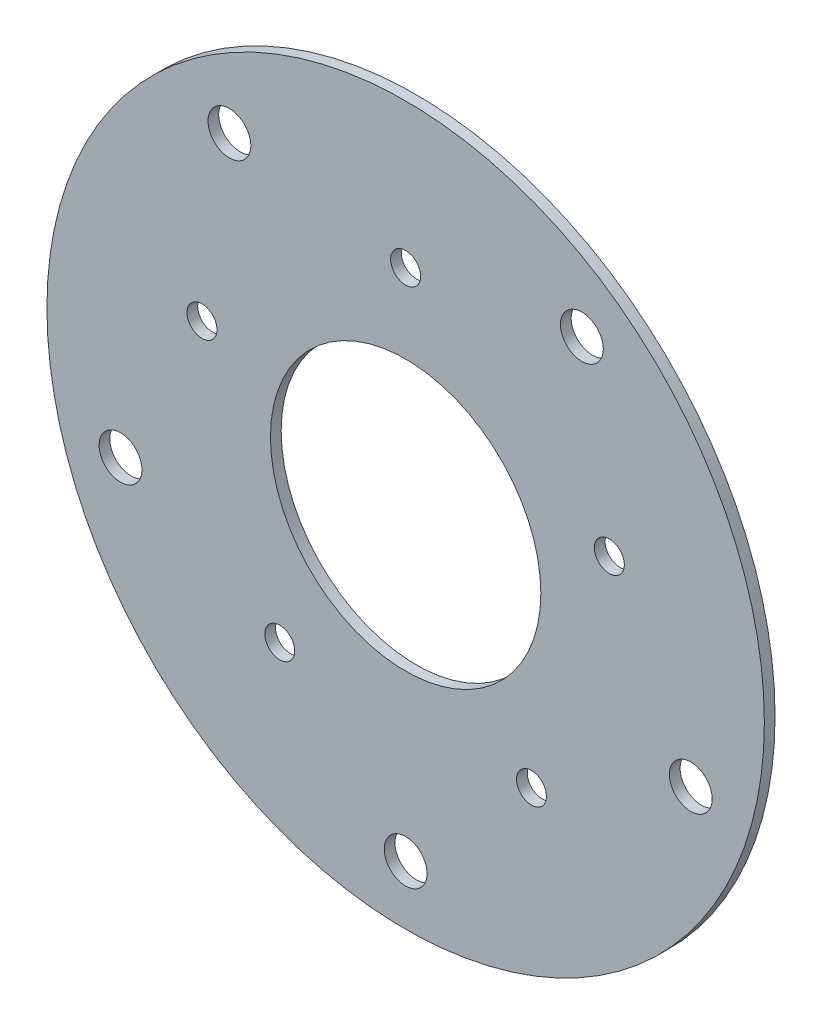
from build123d import *

# Parameters (mm, degrees)
SKETCH_1_R      = 33.5
SKETCH_1_R_2    = 12.625
SKETCH_1_R_3    = 2
SKETCH_1_R_4    = 1.4
EXTRUDE_1_DEPTH = 1


with BuildPart() as part:
    # 草图1 → 凸台-拉伸1 (new body)
    with BuildSketch(Plane.XY):
        Circle(SKETCH_1_R)
        Circle(SKETCH_1_R_2, mode=Mode.SUBTRACT)
        with Locations((0, -28)):
            Circle(SKETCH_1_R_3, mode=Mode.SUBTRACT)
        with Locations((-26.629582456, -8.652475842)):
            Circle(SKETCH_1_R_3, mode=Mode.SUBTRACT)
        with Locations((-16.457987064, 22.652475842)):
            Circle(SKETCH_1_R_3, mode=Mode.SUBTRACT)
        with Locations((16.457987064, 22.652475842)):
            Circle(SKETCH_1_R_3, mode=Mode.SUBTRACT)
        with Locations((26.629582456, -8.652475842)):
            Circle(SKETCH_1_R_3, mode=Mode.SUBTRACT)
        with Locations((-11.755705046, -16.180339887)):
            Circle(SKETCH_1_R_4, mode=Mode.SUBTRACT)
        with Locations((-19.021130326, 6.180339887)):
            Circle(SKETCH_1_R_4, mode=Mode.SUBTRACT)
        with Locations((0, 20)):
            Circle(SKETCH_1_R_4, mode=Mode.SUBTRACT)
        with Locations((19.021130326, 6.180339887)):
            Circle(SKETCH_1_R_4, mode=Mode.SUBTRACT)
        with Locations((11.755705046, -16.180339887)):
            Circle(SKETCH_1_R_4, mode=Mode.SUBTRACT)
    extrude(amount=EXTRUDE_1_DEPTH)


solid = part.part
